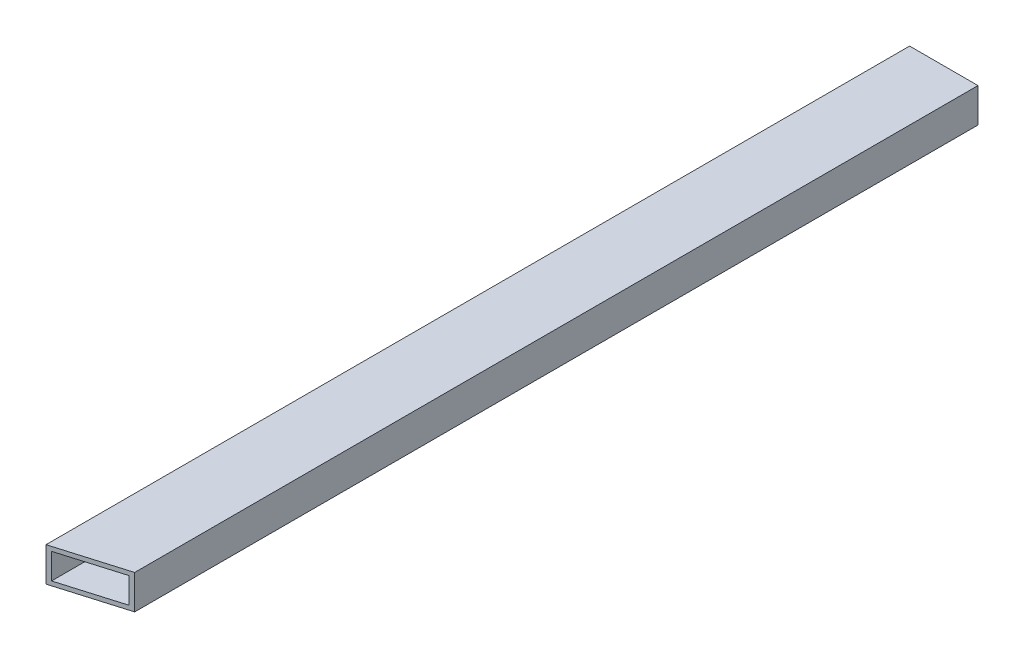
from build123d import *

# Parameters (mm, degrees)
BOSS_EXTRUDE1_DEPTH      = 320.675
BOSS_EXTRUDE1_DEPTH_BACK = 320.675
SKETCH3_W                = 50.8
SKETCH3_H                = 25.4
SKETCH3_W_2              = 44.45
SKETCH3_H_2              = 19.05
CUT_EXTRUDE1_DEPTH       = 323.680609311
CUT_EXTRUDE1_DEPTH_BACK  = 323.680609311


with BuildPart() as part:
    # Sketch3 → Boss-Extrude1 (new, two sides: drawn at the far end of the back side and taken through both)
    with BuildSketch(Plane.XY.offset(-BOSS_EXTRUDE1_DEPTH_BACK)):
        Rectangle(SKETCH3_W, SKETCH3_H)
        Rectangle(SKETCH3_W_2, SKETCH3_H_2, mode=Mode.SUBTRACT)
    extrude(amount=BOSS_EXTRUDE1_DEPTH + BOSS_EXTRUDE1_DEPTH_BACK)

    # Sketch4 → Cut-Extrude1 (cut, two sides: drawn at the far end of the back side and taken through both)
    with BuildSketch(Plane(origin=(0, 12.7, 0), x_dir=(1, 0, 0), z_dir=(0, 1, 0)).offset(-CUT_EXTRUDE1_DEPTH_BACK)):
        Polygon((1322.117470931, -320.675), (25.4, -320.675), (-25.4, -320.675), (25.4, -305.627354456), (1268.718301677, 62.660305034), (3837.350959621, 420.474595165), (3890.750128875, 37.139290131), align=None)
    extrude(amount=CUT_EXTRUDE1_DEPTH + CUT_EXTRUDE1_DEPTH_BACK, mode=Mode.SUBTRACT)


solid = part.part
